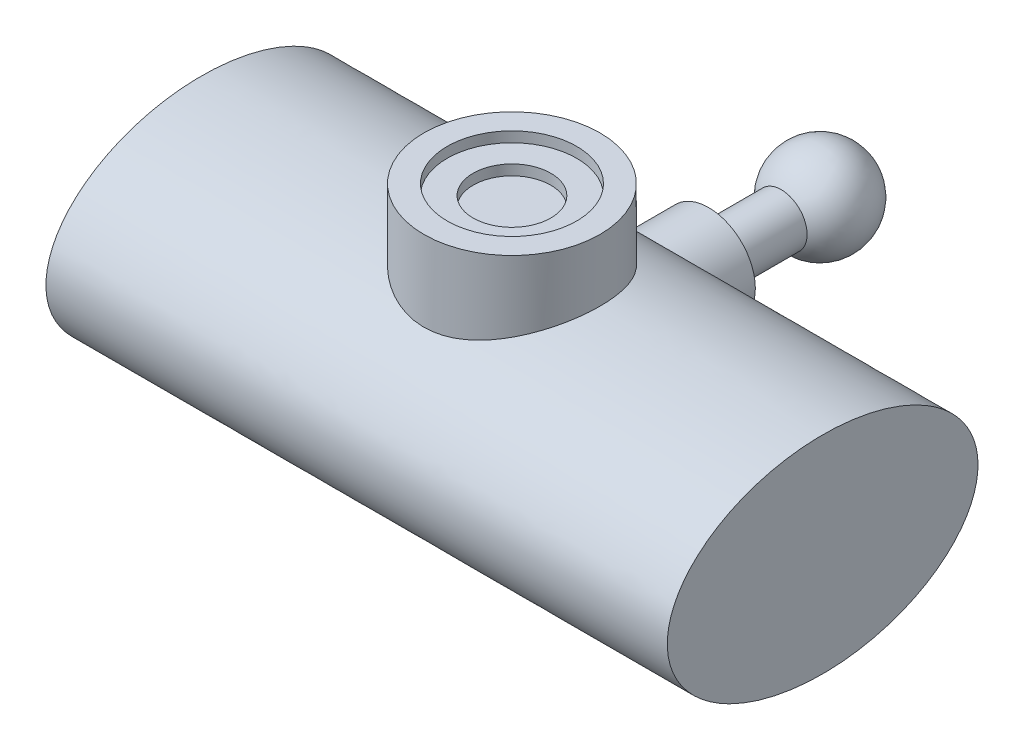
from build123d import *

# Parameters (mm, degrees)
SKETCH_1_R           = 2.5
EXTRUDE_1_DEPTH      = 7
SKETCH_2_R           = 4.5
EXTRUDE_2_DEPTH      = 10
EXTRUDE_3_DEPTH      = 30
EXTRUDE_3_DEPTH_BACK = 30
SKETCH_3_RX          = 15
SKETCH_3_RY          = 10
SKETCH_4_R           = 8.5
EXTRUDE_4_DEPTH      = 16
SKETCH_5_R           = 6.25
CUT_EXTRUDE_1_DEPTH  = 1
SKETCH_6_R           = 3.75
CUT_EXTRUDE_2_DEPTH  = 1


with BuildPart() as part:
    # 草图1 → 凸台-拉伸1 (new body)
    with BuildSketch(Plane.XY):
        Circle(SKETCH_1_R)
    extrude(amount=EXTRUDE_1_DEPTH)

    # 草图2 → 凸台-拉伸2 (add)
    with BuildSketch(Plane.XY.offset(7)):
        Circle(SKETCH_2_R)
    extrude(amount=EXTRUDE_2_DEPTH)

    # 草图3 → 凸台-拉伸3 (add, two sides: drawn at the far end of the back side and taken through both)
    with BuildSketch(Plane(origin=(0, 0, 0), x_dir=(0, 0, -1), z_dir=(1, 0, 0)).offset(-EXTRUDE_3_DEPTH_BACK)):
        with Locations((-26, 0)):
            Ellipse(SKETCH_3_RX, SKETCH_3_RY)
    extrude(amount=EXTRUDE_3_DEPTH + EXTRUDE_3_DEPTH_BACK)

    # 草图4 → 凸台-拉伸4 (add)
    with BuildSketch(Plane(origin=(0, 0, 0), x_dir=(1, 0, 0), z_dir=(0, 1, 0))):
        with Locations((0, -26)):
            Circle(SKETCH_4_R)
    extrude(amount=EXTRUDE_4_DEPTH)

    # 草图5 → 切除-拉伸1 (cut)
    with BuildSketch(Plane(origin=(0, 16, 0), x_dir=(1, 0, 0), z_dir=(0, 1, 0))):
        with Locations((0, -26)):
            Circle(SKETCH_5_R)
    extrude(amount=-CUT_EXTRUDE_1_DEPTH, mode=Mode.SUBTRACT)

    # 草图6 → 切除-拉伸2 (cut)
    with BuildSketch(Plane(origin=(0, 15, 0), x_dir=(1, 0, 0), z_dir=(0, 1, 0))):
        with Locations((0, -26)):
            Circle(SKETCH_6_R)
    extrude(amount=-CUT_EXTRUDE_2_DEPTH, mode=Mode.SUBTRACT)

    # 草图7 → 旋转3 (revolve)
    with BuildSketch(Plane(origin=(0, 0, 0), x_dir=(1, 0, 0), z_dir=(0, 1, 0))):
        with BuildLine():
            Line((0, -0.758342613), (0, 8.241657387))
            ThreePointArc((0, 8.241657387), (4.5, 3.741657387), (0, -0.758342613))
        make_face()
    revolve(axis=Axis((0, 0, -10.703740256), (0, 0, 1)))


solid = part.part
